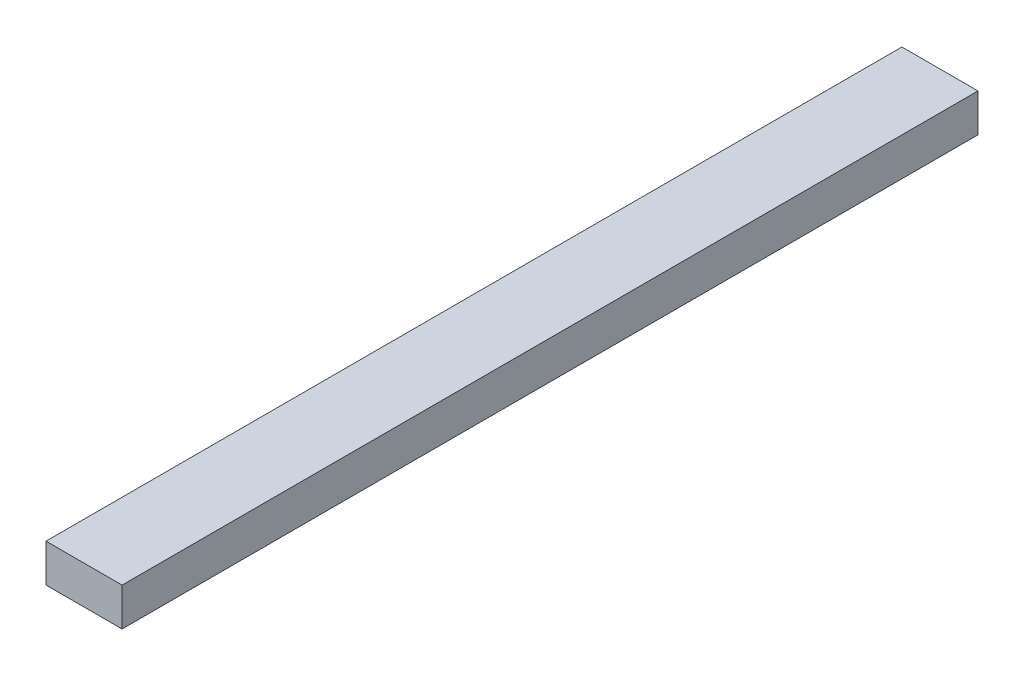
from build123d import *

# Parameters (mm, degrees)
SKETCH_1_W      = 40
SKETCH_1_H      = 20
EXTRUDE_1_DEPTH = 450


with BuildPart() as part:
    # 草图1 → 凸台-拉伸1 (new body)
    with BuildSketch(Plane.XY):
        Rectangle(SKETCH_1_W, SKETCH_1_H)
    extrude(amount=EXTRUDE_1_DEPTH)


solid = part.part
